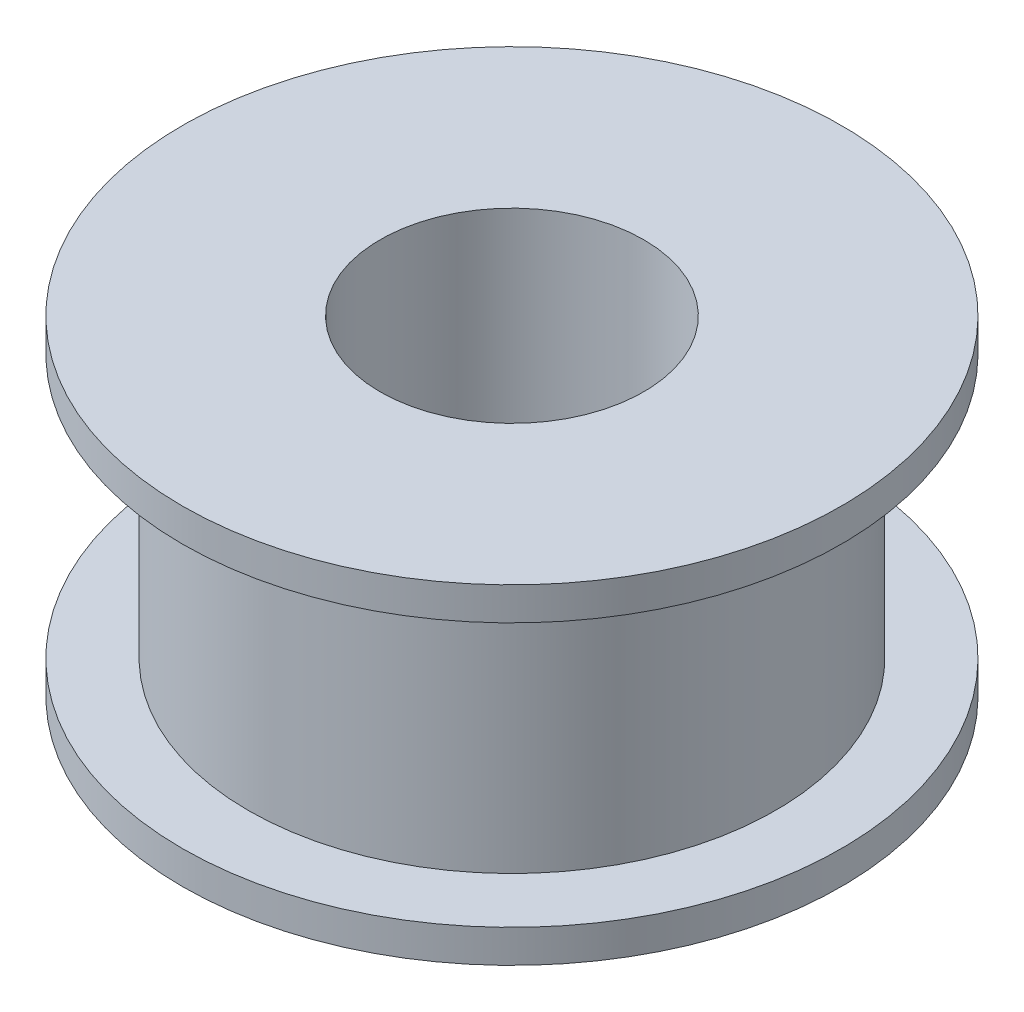
from build123d import *

# Parameters (mm, degrees)
SKETCH1_R           = 25.4
SKETCH1_R_2         = 12.7
BOSS_EXTRUDE1_DEPTH = 25.4
SKETCH4_R           = 31.75
SKETCH4_R_2         = 12.7
BOSS_EXTRUDE3_DEPTH = 3.175


with BuildPart() as part:
    # Sketch1 → Boss-Extrude1 (new body)
    with BuildSketch(Plane(origin=(0, 0, 0), x_dir=(1, 0, 0), z_dir=(0, 1, 0))):
        with Locations(Location((0, 0, 0), (0, 0, 270))):
            Circle(SKETCH1_R)
        with Locations(Location((0, 0, 0), (0, 0, 270))):
            Circle(SKETCH1_R_2, mode=Mode.SUBTRACT)
    extrude(amount=BOSS_EXTRUDE1_DEPTH)

    # Sketch4 → Boss-Extrude3 (add)
    with BuildSketch(Plane(origin=(0, 25.4, 0), x_dir=(1, 0, 0), z_dir=(0, 1, 0))):
        with Locations(Location((0, 0, 0), (0, 0, 270))):
            Circle(SKETCH4_R)
        with Locations(Location((0, 0, 0), (0, 0, 270))):
            Circle(SKETCH4_R_2, mode=Mode.SUBTRACT)
    boss_extrude3 = extrude(amount=BOSS_EXTRUDE3_DEPTH)

    # Mirror2: Boss-Extrude3 across plane
    add(boss_extrude3.mirror(Plane.ZX.offset(12.7)))


solid = part.part
